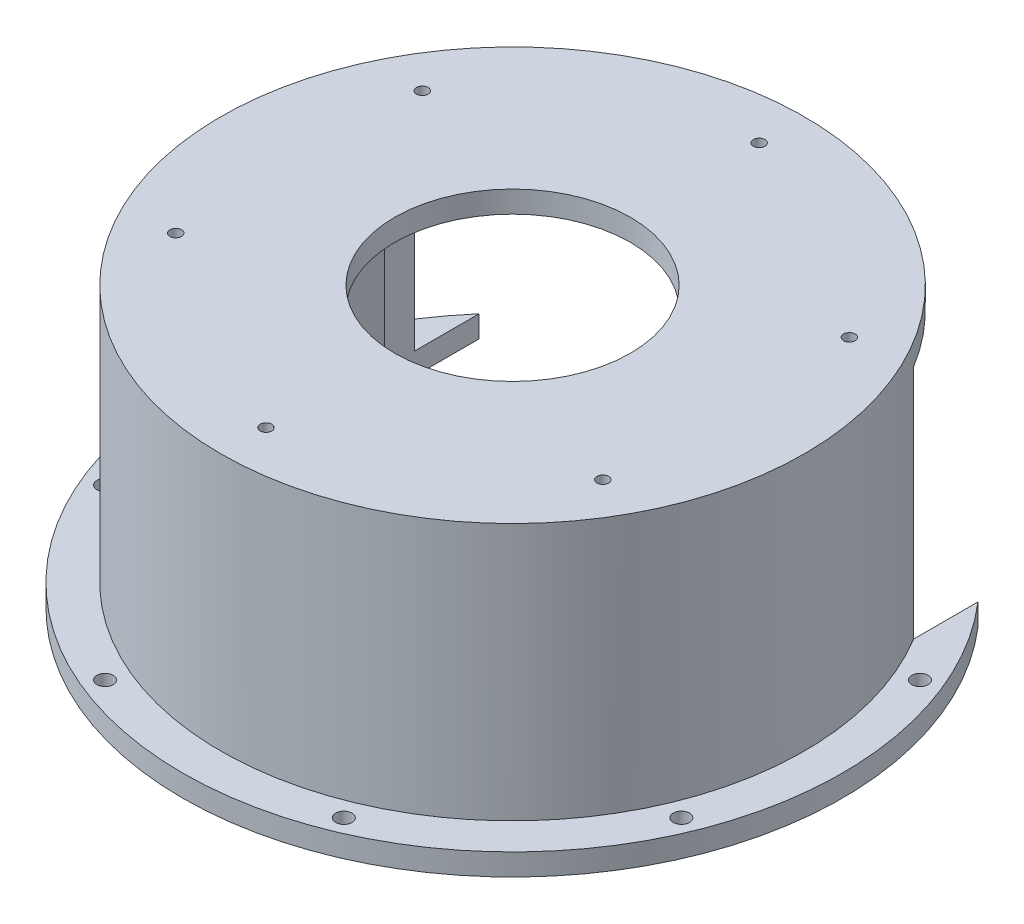
from build123d import *

# Parameters (mm, degrees)
SKETCH1_R                   = 144.4625
BOSS_EXTRUDE1_DEPTH         = 9.525
F_1_4_CLEARANCE_HOLE1_D     = 7.14248
SKETCH4_R                   = 127.79375
SKETCH4_R_2                 = 121.44375
BOSS_EXTRUDE2_DEPTH         = 112.7125
BOSS_EXTRUDE3_START         = -9.525
SKETCH5_R                   = 121.44375
BOSS_EXTRUDE3_DEPTH         = 9.525
CUT_EXTRUDE1_REACH          = 240.077
SKETCH6_R                   = 121.44375
CUT_EXTRUDE2_REACH          = 240.077
SKETCH7_R                   = 51.59375
SKETCH10_W                  = 218.44
SKETCH10_H                  = 91.362820019
CUT_EXTRUDE3_DEPTH          = 112.7125
TAP_DRILL_FOR_1_4_20_TAP1_D = 5.1054


with BuildPart() as part:
    # Sketch1 → Boss-Extrude1 (new body)
    with BuildSketch(Plane(origin=(0, 0, 0), x_dir=(1, 0, 0), z_dir=(0, 1, 0))):
        with Locations(Location((0, 0, 0), (0, 0, 90))):
            Circle(SKETCH1_R)
    extrude(amount=BOSS_EXTRUDE1_DEPTH)

    # 1/4 Clearance Hole1 (through all)
    with Locations(Plane(origin=(0, 9.525, 0), x_dir=(1, 0, 0), z_dir=(0, 1, 0))):
        with Locations((0, 136.525), (-52.245855604, 126.132653176), (52.245855604, 126.132653176), (126.132653176, 52.245855604), (126.132653176, -52.245855604), (52.245855604, -126.132653176), (-52.245855604, -126.132653176), (-126.132653176, -52.245855604), (-126.132653176, 52.245855604)):
            Hole(F_1_4_CLEARANCE_HOLE1_D / 2)

    # Sketch4 → Boss-Extrude2 (add)
    with BuildSketch(Plane(origin=(0, 9.525, 0), x_dir=(1, 0, 0), z_dir=(0, 1, 0))):
        with Locations(Location((0, 0, 0), (0, 0, 90))):
            Circle(SKETCH4_R)
        with Locations(Location((0, 0, 0), (0, 0, 90))):
            Circle(SKETCH4_R_2, mode=Mode.SUBTRACT)
    extrude(amount=BOSS_EXTRUDE2_DEPTH)

    # Sketch5 → Boss-Extrude3 (add)
    with BuildSketch(Plane(origin=(0, 122.2375, 0), x_dir=(1, 0, 0), z_dir=(0, 1, 0)).offset(BOSS_EXTRUDE3_START)):
        with Locations(Location((0, 0, 0), (0, 0, 90))):
            Circle(SKETCH5_R)
    extrude(amount=BOSS_EXTRUDE3_DEPTH)

    # Sketch6 → Cut-Extrude1 (cut, up to next)
    with BuildSketch(Plane.XZ, mode=Mode.PRIVATE) as cut_extrude1_sk1:
        with Locations(Location((0, 0, 0), (0, 0, 270))):
            Circle(SKETCH6_R)
    cut_extrude1_tool1 = extrude(cut_extrude1_sk1.sketch, amount=-CUT_EXTRUDE1_REACH, mode=Mode.PRIVATE) & part.part
    add(cut_extrude1_tool1.solids().sort_by_distance((0, 0, 0))[0], mode=Mode.SUBTRACT)

    # Sketch7 → Cut-Extrude2 (cut, up to next)
    with BuildSketch(Plane(origin=(0, 122.2375, 0), x_dir=(1, 0, 0), z_dir=(0, 1, 0)), mode=Mode.PRIVATE) as cut_extrude2_sk1:
        with Locations(Location((0, 0, 0), (0, 0, 270))):
            Circle(SKETCH7_R)
    cut_extrude2_tool1 = extrude(cut_extrude2_sk1.sketch, amount=-CUT_EXTRUDE2_REACH, mode=Mode.PRIVATE) & part.part
    add(cut_extrude2_tool1.solids().sort_by_distance((0, 122.2375, 0))[0], mode=Mode.SUBTRACT)

    # Sketch10 → Cut-Extrude3 (cut)
    with BuildSketch(Plane(origin=(0, 0, 0), x_dir=(1, 0, 0), z_dir=(0, 1, 0))):
        with Locations((0, 98.781089991)):
            Rectangle(SKETCH10_W, SKETCH10_H)
    extrude(amount=CUT_EXTRUDE3_DEPTH, mode=Mode.SUBTRACT)

    # Tap Drill for 1/4-20 Tap1 (through all)
    with Locations(Plane(origin=(0, 122.2375, 0), x_dir=(1, 0, 0), z_dir=(0, 1, 0))):
        with Locations((93.487442339, -53.975), (0, -107.95), (-93.487442339, -53.975), (-93.487442339, 53.975), (0, 107.95), (93.487442339, 53.975)):
            Hole(TAP_DRILL_FOR_1_4_20_TAP1_D / 2)


solid = part.part
